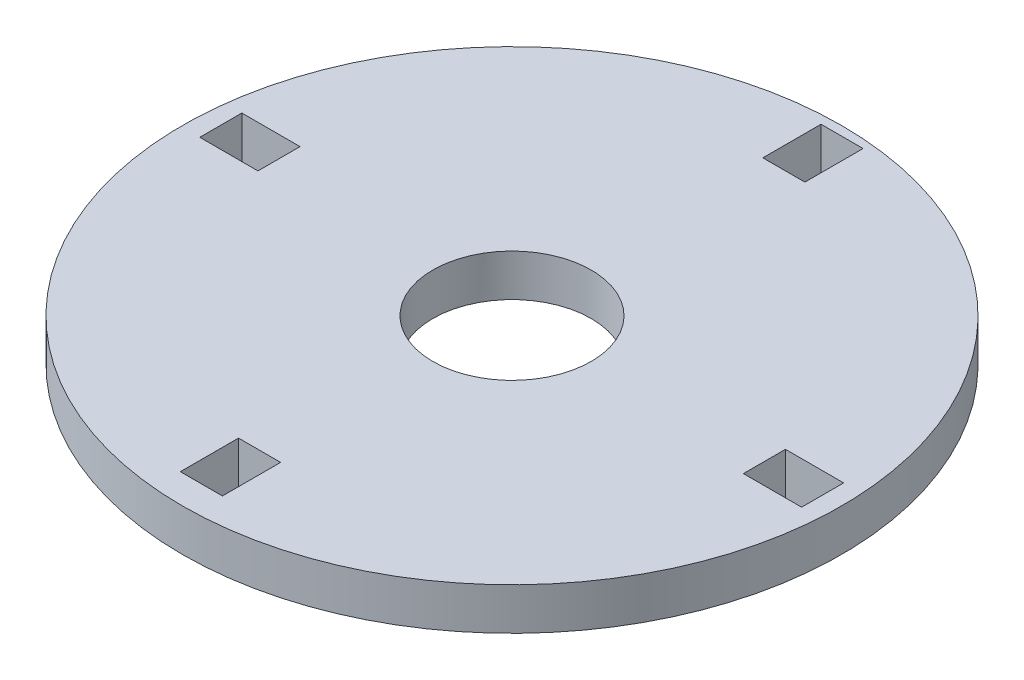
from build123d import *

# Parameters (mm, degrees)
SKICA1_R                 = 16.78
P_IDAT_VYSUNUT_M1_DEPTH  = 50.7
SKICA2_R                 = 5.65
P_IDAT_VYSUNUT_M2_DEPTH  = 4.61
SKICA3_R                 = 1.565
P_IDAT_VYSUNUT_M3_DEPTH  = 8.5
SKETCH6_R                = 23.5
BOSS_EXTRUDE1_DEPTH      = 3
SKICA4_R                 = 47.025805565
ODEBRAT_VYSUNUT_M2_DEPTH = 63.81
SKICA5_R                 = 5.65
ODEBRAT_VYSUNUT_M3_DEPTH = 10
SKETCH8_W                = 3
SKETCH8_H                = 4.15
SKETCH8_W_2              = 4.15
SKETCH8_H_2              = 3
ODEBRAT_VYSUNUT_M4_DEPTH = 3


with BuildPart() as part:
    # Skica1 → Přidat vysunutím1 (new body)
    with BuildSketch(Plane(origin=(0, 0, 0), x_dir=(1, 0, 0), z_dir=(0, 1, 0))):
        with Locations(Location((0, 0, 0), (0, 0, 90))):
            Circle(SKICA1_R)
    extrude(amount=P_IDAT_VYSUNUT_M1_DEPTH)

    # Skica2 → Přidat vysunutím2 (add)
    with BuildSketch(Plane(origin=(0, 50.7, 0), x_dir=(1, 0, 0), z_dir=(0, 1, 0))):
        with Locations(Location((0, 0, 0), (0, 0, 270))):
            Circle(SKICA2_R)
    extrude(amount=P_IDAT_VYSUNUT_M2_DEPTH)

    # Skica3 → Přidat vysunutím3 (add)
    with BuildSketch(Plane(origin=(0, 55.31, 0), x_dir=(1, 0, 0), z_dir=(0, 1, 0))):
        with Locations(Location((0, 0, 0), (0, 0, 270))):
            Circle(SKICA3_R)
    extrude(amount=P_IDAT_VYSUNUT_M3_DEPTH)

    # Sketch6 → Boss-Extrude1 (add)
    with BuildSketch(Plane.XZ):
        with Locations(Location((0, 0, 0), (0, 0, 270))):
            Circle(SKETCH6_R)
    extrude(amount=BOSS_EXTRUDE1_DEPTH)

    # Skica4 → Odebrat vysunutím2 (cut)
    with BuildSketch(Plane(origin=(0, 63.81, 0), x_dir=(1, 0, 0), z_dir=(0, 1, 0))):
        Circle(SKICA4_R)
    extrude(amount=-ODEBRAT_VYSUNUT_M2_DEPTH, mode=Mode.SUBTRACT)

    # Skica5 → Odebrat vysunutím3 (cut)
    with BuildSketch(Plane(origin=(0, 0, 0), x_dir=(1, 0, 0), z_dir=(0, 1, 0))):
        with Locations(Location((0, 0, 0), (0, 0, 270))):
            Circle(SKICA5_R)
    extrude(amount=-ODEBRAT_VYSUNUT_M3_DEPTH, mode=Mode.SUBTRACT)

    # Sketch8 → Odebrat vysunutím4 (cut)
    with BuildSketch(Plane(origin=(0, 0, 0), x_dir=(1, 0, 0), z_dir=(0, 1, 0))):
        with Locations((-0.692634125, -19.382365875)):
            Rectangle(SKETCH8_W, SKETCH8_H)
        with Locations((20.075, 0)):
            Rectangle(SKETCH8_W_2, SKETCH8_H_2)
        with Locations((-20.075, 1.38526825)):
            Rectangle(SKETCH8_W_2, SKETCH8_H_2)
        with Locations((0.692634125, 20.767634125)):
            Rectangle(SKETCH8_W, SKETCH8_H)
    extrude(amount=-ODEBRAT_VYSUNUT_M4_DEPTH, mode=Mode.SUBTRACT)


solid = part.part
